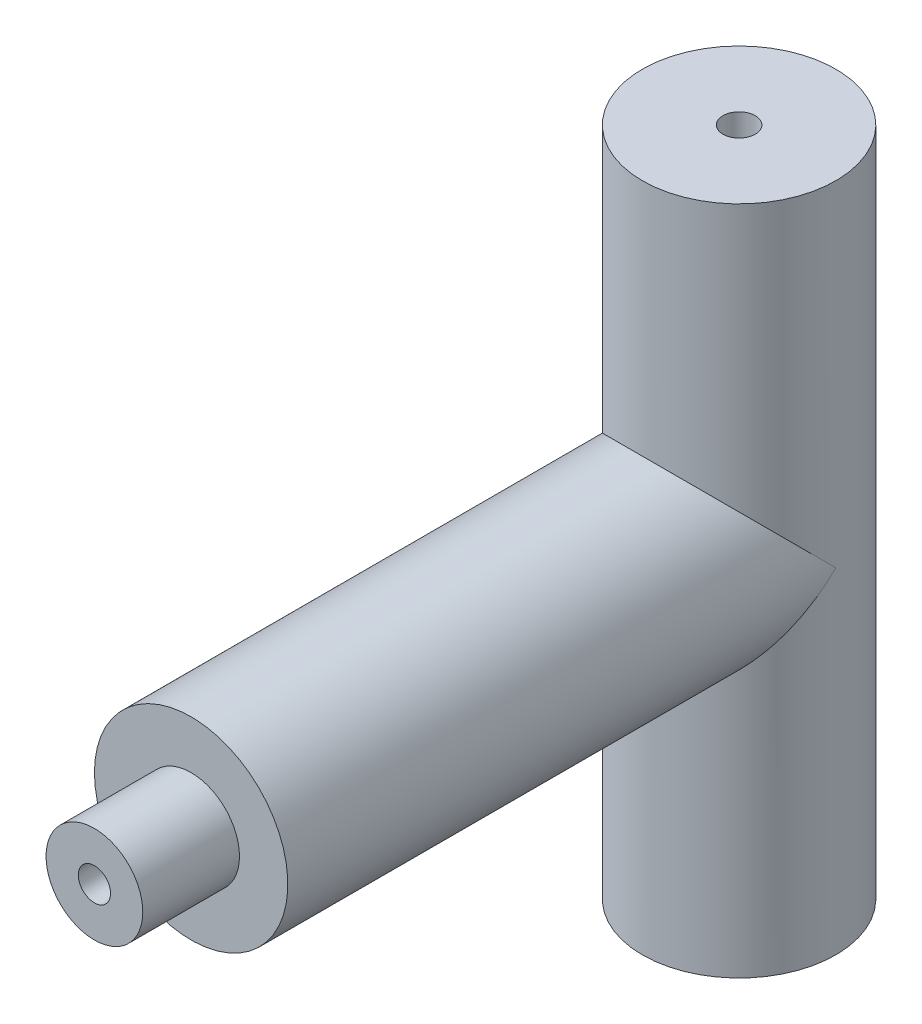
from build123d import *

# Parameters (mm, degrees)
SKETCH1_R           = 7.5
BOSS_EXTRUDE1_DEPTH = 15
SKETCH7_R           = 2.5
CUT_EXTRUDE2_DEPTH  = 5
SKETCH2_R           = 15
BOSS_EXTRUDE2_DEPTH = 100
CUT_EXTRUDE3_DEPTH  = 52
SKETCH9_R           = 15
BOSS_EXTRUDE4_DEPTH = 52
SKETCH10_R          = 2.5
CUT_EXTRUDE4_DEPTH  = 5


with BuildPart() as part:
    # Sketch1 → Boss-Extrude1 (new body)
    with BuildSketch(Plane.XY):
        Circle(SKETCH1_R)
    extrude(amount=-BOSS_EXTRUDE1_DEPTH)

    # Sketch7 → Cut-Extrude2 (cut)
    with BuildSketch(Plane.XY):
        Circle(SKETCH7_R)
    extrude(amount=-CUT_EXTRUDE2_DEPTH, mode=Mode.SUBTRACT)

    # Sketch2 → Boss-Extrude2 (add)
    with BuildSketch(Plane(origin=(0, 0, -15), x_dir=(-1, 0, 0), z_dir=(0, 0, -1))):
        Circle(SKETCH2_R)
    extrude(amount=BOSS_EXTRUDE2_DEPTH)

    # Sketch8 → Cut-Extrude3 (cut, symmetric)
    with BuildSketch(Plane(origin=(0, 0, 0), x_dir=(1, 0, 0), z_dir=(0, 1, 0))):
        with BuildLine():
            Line((15, 165), (-15, 165))
            Line((-15, 165), (-15, 100))
            ThreePointArc((-15, 100), (0, 115), (15, 100))
            Line((15, 100), (15, 165))
        make_face()
    extrude(amount=CUT_EXTRUDE3_DEPTH, both=True, mode=Mode.SUBTRACT)

    # Sketch9 → Boss-Extrude4 (add, symmetric)
    with BuildSketch(Plane(origin=(0, 0, 0), x_dir=(1, 0, 0), z_dir=(0, 1, 0))):
        with Locations(Location((0, 100, 0), (0, 0, 270))):
            Circle(SKETCH9_R)
    extrude(amount=BOSS_EXTRUDE4_DEPTH, both=True)

    # Sketch10 → Cut-Extrude4 (cut)
    with BuildSketch(Plane.XZ.offset(52)):
        with Locations(Location((0, -100, 0), (0, 0, 270))):
            Circle(SKETCH10_R)
    cut_extrude4 = extrude(amount=-CUT_EXTRUDE4_DEPTH, mode=Mode.SUBTRACT)

    # Mirror1: Cut-Extrude4 across plane
    add(cut_extrude4.mirror(Plane.ZX), mode=Mode.SUBTRACT)


solid = part.part
